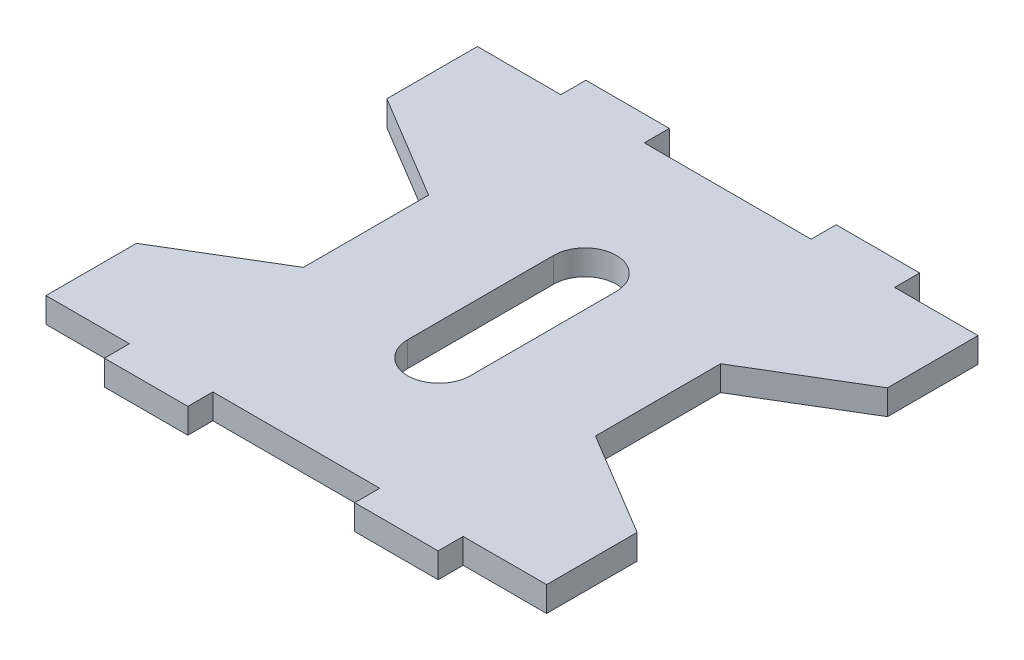
from build123d import *

# Parameters (mm, degrees)
EXTRUDE_1_DEPTH = 3


with BuildPart() as part:
    # 草图2 → 凸台-拉伸1 (new body)
    with BuildSketch(Plane(origin=(0, 0, 0), x_dir=(1, 0, 0), z_dir=(0, 1, 0))):
        Polygon((-10, 25.85), (10, 25.85), (10, 28.85), (20, 28.85), (20, 25.85), (30, 25.85), (30, 15), (17.5, 7.5), (17.5, -7.5), (30, -15), (30, -25.85), (20, -25.85), (20, -28.85), (10, -28.85), (10, -25.85), (-10, -25.85), (-10, -28.85), (-20, -28.85), (-20, -25.85), (-30, -25.85), (-30, -15), (-17.5, -7.5), (-17.5, 7.5), (-30, 15), (-30, 25.85), (-20, 25.85), (-20, 28.85), (-10, 28.85), align=None)
        with BuildLine():
            Line((3.75, -8.75), (3.75, 8.75))
            ThreePointArc((3.75, 8.75), (0, 12.5), (-3.75, 8.75))
            Line((-3.75, 8.75), (-3.75, -8.75))
            ThreePointArc((-3.75, -8.75), (0, -12.5), (3.75, -8.75))
        make_face(mode=Mode.SUBTRACT)
    extrude(amount=EXTRUDE_1_DEPTH)


solid = part.part
